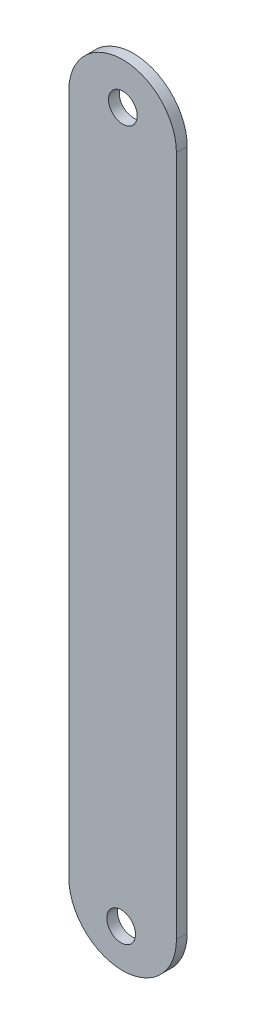
from build123d import *

# Parameters (mm, degrees)
BOSS_EXTRUDE1_DEPTH = 1.5
SKETCH2_R           = 2
CUT_EXTRUDE2_DEPTH  = 1.5


with BuildPart() as part:
    # Sketch1 → Boss-Extrude1 (new body)
    with BuildSketch(Plane.XY):
        with BuildLine():
            Line((-18.731525136, 57.209302326), (-18.731525136, -37.790697674))
            ThreePointArc((-18.731525136, -37.790697674), (-11.231525136, -45.290697674), (-3.731525136, -37.790697674))
            Line((-3.731525136, -37.790697674), (-3.731525136, 57.209302326))
            ThreePointArc((-3.731525136, 57.209302326), (-11.231525136, 64.709302326), (-18.731525136, 57.209302326))
        make_face()
    extrude(amount=BOSS_EXTRUDE1_DEPTH)

    # Sketch2 → Cut-Extrude2 (cut)
    with BuildSketch(Plane.XY.offset(1.5)):
        with Locations((-11.202855026, 58.911044132)):
            Circle(SKETCH2_R)
        with Locations((-11.440398857, -40.029447888)):
            Circle(SKETCH2_R)
    extrude(amount=-CUT_EXTRUDE2_DEPTH, mode=Mode.SUBTRACT)


solid = part.part
